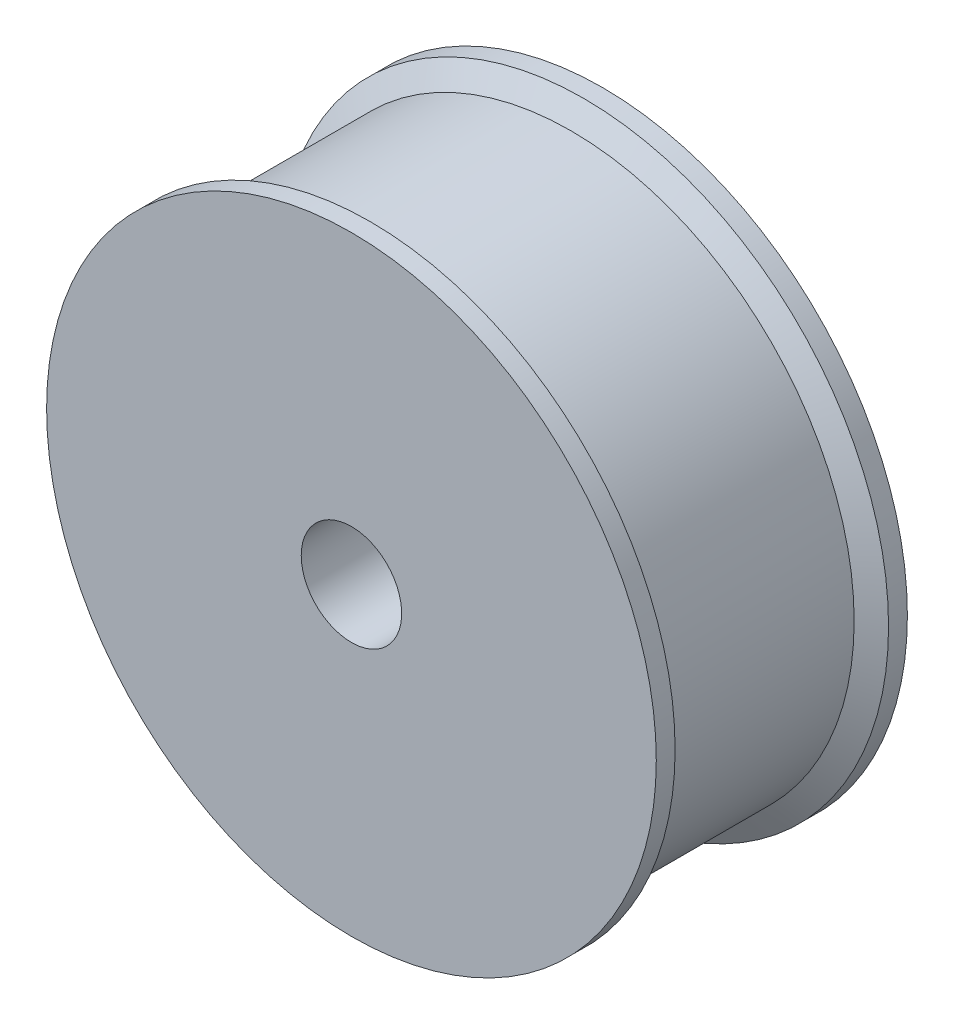
from build123d import *

# Parameters (mm, degrees)
SKICA2_W                 = 8
SKICA2_H                 = 33
ODEBRAT_VYSUNUT_M1_DEPTH = 35


with BuildPart() as part:
    # Skica1 → Rotovat1 (revolve)
    with BuildSketch(Plane(origin=(0, 0, 0), x_dir=(0, 0, -1), z_dir=(1, 0, 0)), mode=Mode.PRIVATE) as rotovat1_sk:
        Polygon((0, 4), (0, 16.5), (-10, 16.5), (-10, 24.28), (-11.5, 24.28), (-12.5, 22.54), (-27.5, 22.54), (-28.5, 24.28), (-30, 24.28), (-30, 4), align=None)
    revolve(rotovat1_sk.sketch.rotate(Axis((0, 0, 0), (0, 0, 1)), 90), axis=Axis((0, 0, 0), (0, 0, 1)))

    # Skica2 → Odebrat vysunutím1 (cut, symmetric)
    with BuildSketch(Plane(origin=(0, 0, 0), x_dir=(0, 0, -1), z_dir=(1, 0, 0))):
        with Locations((-4, 0)):
            Rectangle(SKICA2_W, SKICA2_H)
    extrude(amount=ODEBRAT_VYSUNUT_M1_DEPTH, both=True, mode=Mode.SUBTRACT)


solid = part.part
